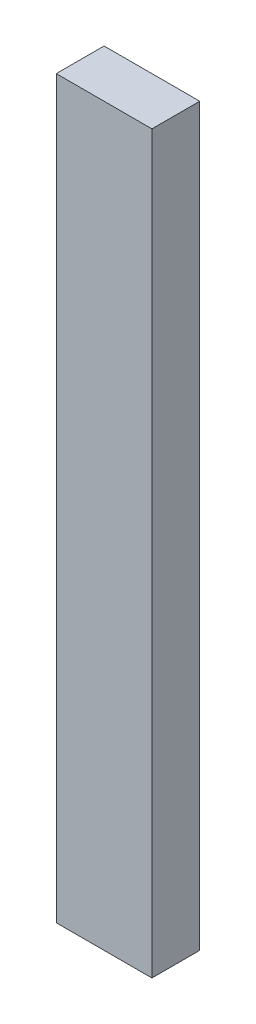
from build123d import *

# Parameters (mm, degrees)
SKETCH1_W           = 25.4
SKETCH1_H           = 12.7
BOSS_EXTRUDE1_DEPTH = 195.2625


with BuildPart() as part:
    # Sketch1 → Boss-Extrude1 (new body)
    with BuildSketch(Plane(origin=(0, 0, 0), x_dir=(1, 0, 0), z_dir=(0, 1, 0))):
        with Locations((12.7, 6.35)):
            Rectangle(SKETCH1_W, SKETCH1_H)
    extrude(amount=BOSS_EXTRUDE1_DEPTH)


solid = part.part
